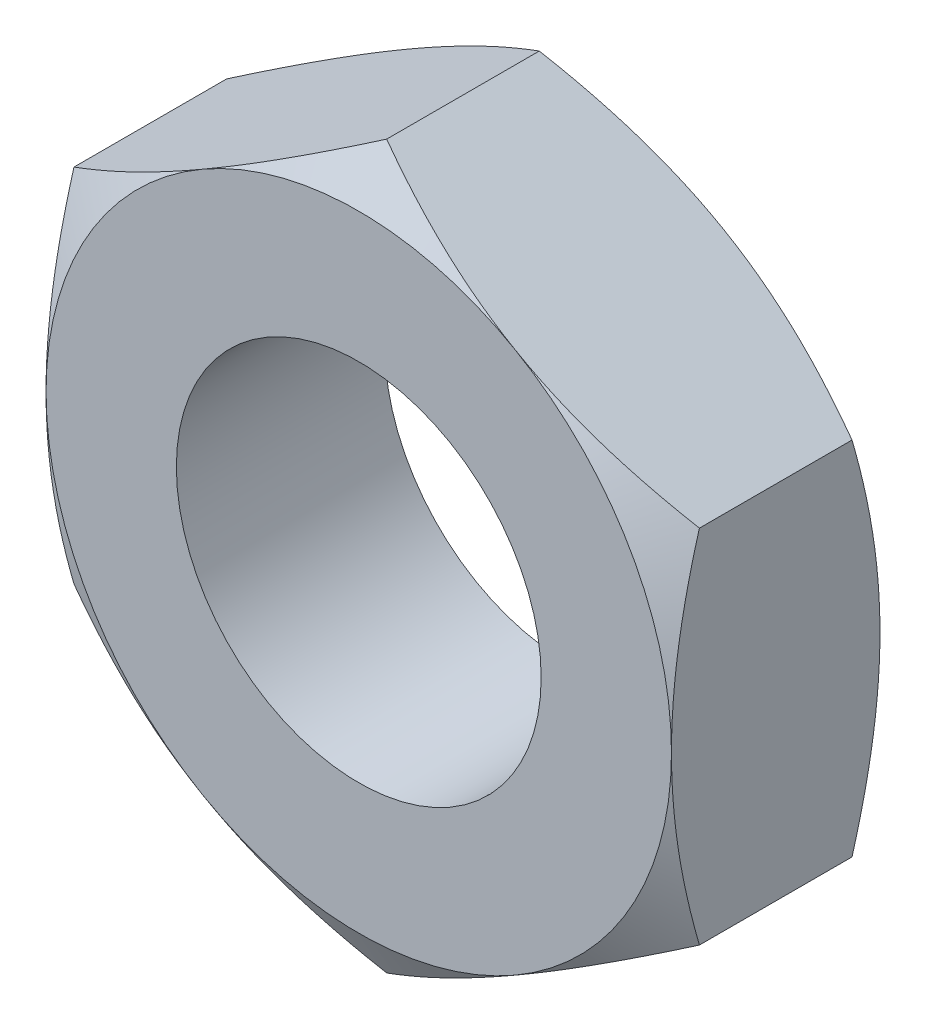
from build123d import *

# Parameters (mm, degrees)
SZKIC1_R                    = 1.75
DODANIE_WYCI_GNI_CIE1_DEPTH = 1
SZKIC2_OUTSIDE_W            = 16.804
SZKIC2_OUTSIDE_H            = 17.732
SZKIC2_OUTSIDE_R            = 3
WYTNIJ_WYCI_GNI_CIE2_DEPTH  = 2
WYTNIJ_WYCI_GNI_CIE2_DRAFT  = -60
LUSTRO1_COPY_1_SKETCH_W     = 16.804
LUSTRO1_COPY_1_SKETCH_H     = 17.732
LUSTRO1_COPY_1_SKETCH_R     = 3
LUSTRO1_COPY_1_DEPTH        = 2
LUSTRO1_COPY_1_DRAFT        = -60


with BuildPart() as part:
    # Szkic1 → Dodanie-wyciągnięcie1 (new, symmetric)
    with BuildSketch(Plane.XY):
        Polygon((-3, 1.732050808), (-3, -1.732050808), (0, -3.464101615), (3, -1.732050808), (3, 1.732050808), (0, 3.464101615), align=None)
        Circle(SZKIC1_R, mode=Mode.SUBTRACT)
    extrude(amount=DODANIE_WYCI_GNI_CIE1_DEPTH, both=True)


with BuildPart() as wytnij_wyci_gni_cie2_tool:
    # Szkic2 outside → Wytnij-wyciągnięcie2 (with draft: the straight prism first)
    with BuildSketch(Plane.XY.offset(1)):
        Rectangle(SZKIC2_OUTSIDE_W, SZKIC2_OUTSIDE_H)
        Circle(SZKIC2_OUTSIDE_R, mode=Mode.SUBTRACT)
    extrude(amount=-WYTNIJ_WYCI_GNI_CIE2_DEPTH)
    # Wytnij-wyciągnięcie2: the draft: its side faces are tilted about the plane it starts from
    wytnij_wyci_gni_cie2_sides = [wytnij_wyci_gni_cie2_tool.faces().sort_by_distance(p)[0] for p in [
        (0, -8.866, 0),
        (8.402, 0, 0),
        (0, 8.866, 0),
        (-8.402, 0, 0),
        (-3, 0, 0),
    ]]
    draft(wytnij_wyci_gni_cie2_sides, Plane.XY.offset(1), WYTNIJ_WYCI_GNI_CIE2_DRAFT)


with BuildPart() as part_1:
    add(part.part)

    # Wytnij-wyciągnięcie2: cut by wytnij_wyci_gni_cie2_tool
    add(wytnij_wyci_gni_cie2_tool.part, mode=Mode.SUBTRACT)


with BuildPart() as lustro1_copy_1_tool:
    # Lustro1 copy 1 sketch → Lustro1 copy 1 (with draft: the straight prism first)
    with BuildSketch(Plane(origin=(0, 0, -1), x_dir=(1, 0, 0), z_dir=(0, 0, -1))):
        Rectangle(LUSTRO1_COPY_1_SKETCH_W, LUSTRO1_COPY_1_SKETCH_H)
        Circle(LUSTRO1_COPY_1_SKETCH_R, mode=Mode.SUBTRACT)
    extrude(amount=-LUSTRO1_COPY_1_DEPTH)
    # Lustro1 copy 1: the draft: its side faces are tilted about the plane it starts from
    lustro1_copy_1_sides = [lustro1_copy_1_tool.faces().sort_by_distance(p)[0] for p in [
        (0, -8.866, 0),
        (8.402, 0, 0),
        (0, 8.866, 0),
        (-8.402, 0, 0),
        (-3, 0, 0),
    ]]
    draft(lustro1_copy_1_sides, Plane(origin=(0, 0, -1), x_dir=(1, 0, 0), z_dir=(0, 0, -1)), LUSTRO1_COPY_1_DRAFT)


with BuildPart() as part_2:
    add(part_1.part)

    # Lustro1 copy 1: cut by lustro1_copy_1_tool
    add(lustro1_copy_1_tool.part, mode=Mode.SUBTRACT)


solid = part_2.part
